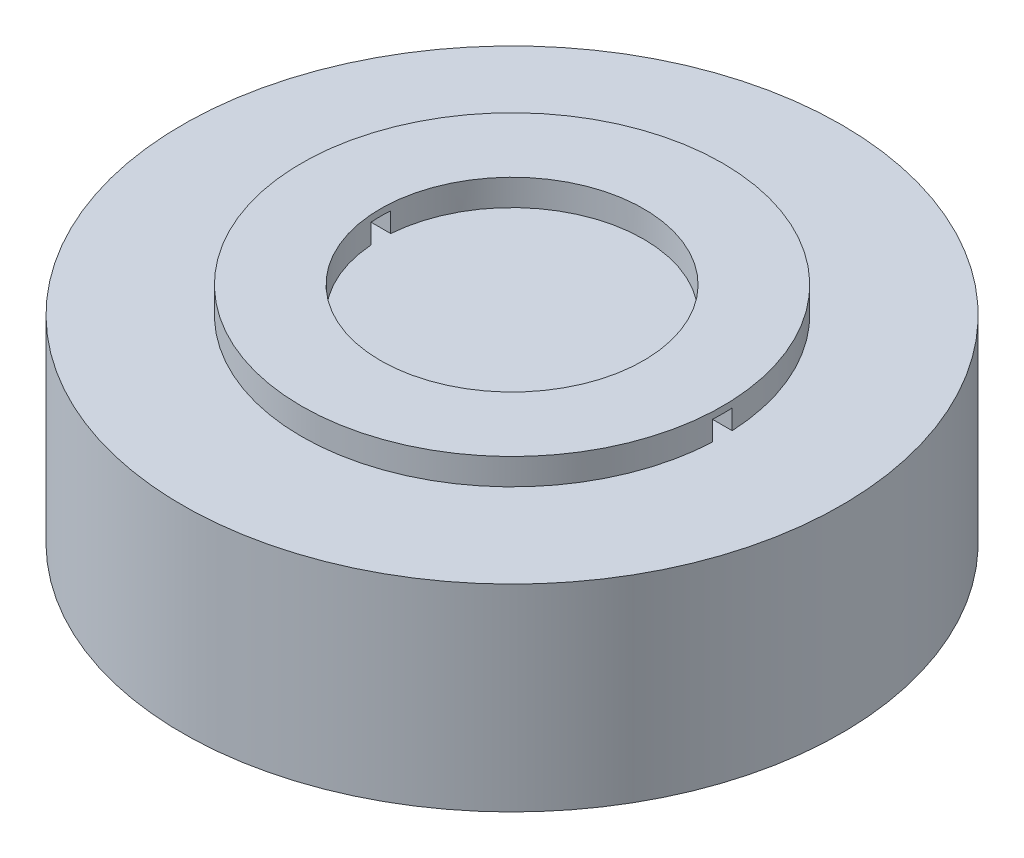
from build123d import *

# Parameters (mm, degrees)
SKETCH_1_R          = 16
EXTRUDE_1_DEPTH     = 2
SKETCH_2_R          = 25.05
EXTRUDE_2_DEPTH     = 15
SKETCH_4_R          = 2
CUT_EXTRUDE_1_DEPTH = 10
SKETCH_6_W          = 60
SKETCH_6_H          = 1.5
CUT_EXTRUDE_2_DEPTH = 1.5
SKETCH_8_R          = 10
CUT_EXTRUDE_3_DEPTH = 2


with BuildPart() as part:
    # 草图1 → 凸台-拉伸1 (new body)
    with BuildSketch(Plane(origin=(0, 0, 0), x_dir=(1, 0, 0), z_dir=(0, 1, 0))):
        with Locations(Location((0, 0, 0), (0, 0, 270))):
            Circle(SKETCH_1_R)
    extrude(amount=-EXTRUDE_1_DEPTH)

    # 草图2 → 凸台-拉伸2 (add)
    with BuildSketch(Plane.XZ.offset(2)):
        with Locations(Location((0, 0, 0), (0, 0, 270))):
            Circle(SKETCH_2_R)
    extrude(amount=EXTRUDE_2_DEPTH)

    # 草图4 → 切除-拉伸1 (cut)
    with BuildSketch(Plane.XZ.offset(17)):
        with Locations(Location((0, 0, 0), (0, 0, 270))):
            Circle(SKETCH_4_R)
    extrude(amount=-CUT_EXTRUDE_1_DEPTH, mode=Mode.SUBTRACT)

    # 草图6 → 切除-拉伸2 (cut)
    with BuildSketch(Plane(origin=(0, -2, 0), x_dir=(1, 0, 0), z_dir=(0, 1, 0))):
        Rectangle(SKETCH_6_W, SKETCH_6_H)
    extrude(amount=CUT_EXTRUDE_2_DEPTH, mode=Mode.SUBTRACT)

    # 草图8 → 切除-拉伸3 (cut)
    with BuildSketch(Plane(origin=(0, 0, 0), x_dir=(1, 0, 0), z_dir=(0, 1, 0))):
        with Locations(Location((0, 0, 0), (0, 0, 270))):
            Circle(SKETCH_8_R)
    extrude(amount=-CUT_EXTRUDE_3_DEPTH, mode=Mode.SUBTRACT)


solid = part.part
